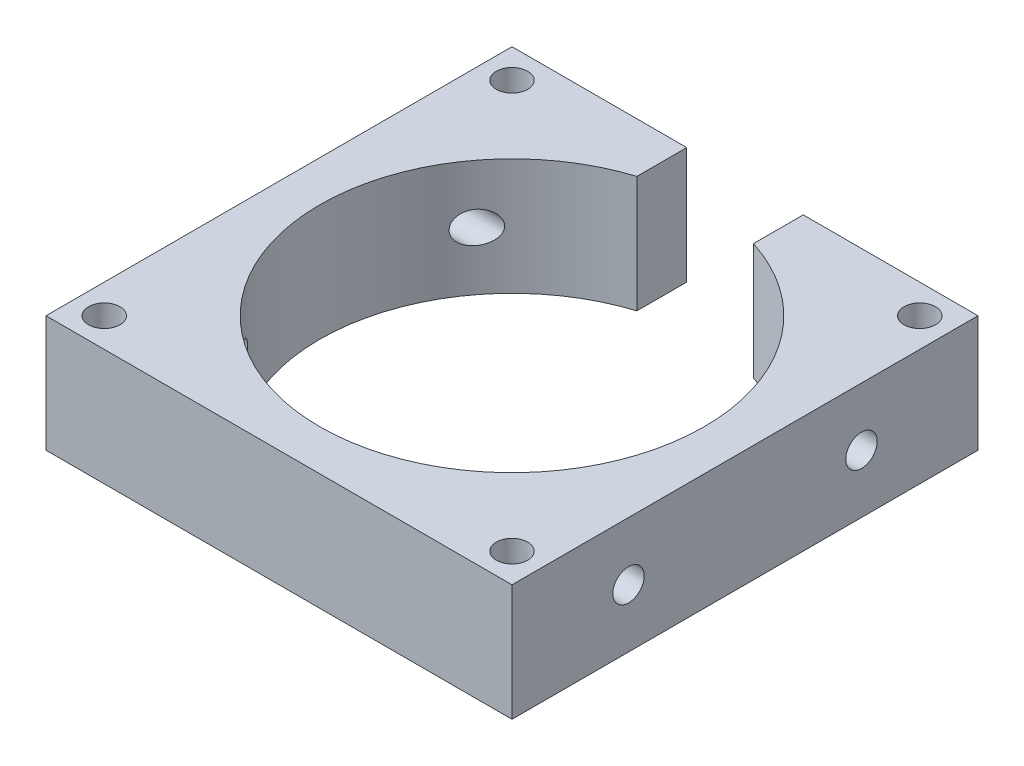
from build123d import *

# Parameters (mm, degrees)
SKETCH1_W           = 101.6
SKETCH1_H           = 101.6
BOSS_EXTRUDE1_DEPTH = 25.4
SKETCH2_R           = 41.91
CUT_EXTRUDE1_DEPTH  = 77.2
SKETCH3_W           = 25.4
SKETCH3_H           = 34.66394105
CUT_EXTRUDE2_DEPTH  = 77.2
SKETCH4_R           = 3.429
CUT_EXTRUDE3_DEPTH  = 77.2
SKETCH5_R           = 3.429
CUT_EXTRUDE4_DEPTH  = 117.397422652


with BuildPart() as part:
    # Sketch1 → Boss-Extrude1 (new body)
    with BuildSketch(Plane(origin=(0, 0, 0), x_dir=(1, 0, 0), z_dir=(0, 1, 0))):
        Rectangle(SKETCH1_W, SKETCH1_H)
    extrude(amount=BOSS_EXTRUDE1_DEPTH)

    # Sketch2 → Cut-Extrude1 (cut, through all)
    with BuildSketch(Plane(origin=(0, 25.4, 0), x_dir=(1, 0, 0), z_dir=(0, 1, 0))):
        with Locations(Location((0, 0, 0), (0, 0, 270))):
            Circle(SKETCH2_R)
    extrude(amount=-CUT_EXTRUDE1_DEPTH, mode=Mode.SUBTRACT)

    # Sketch3 → Cut-Extrude2 (cut, through all)
    with BuildSketch(Plane(origin=(0, 0, 0), x_dir=(1, 0, 0), z_dir=(0, 1, 0))):
        with Locations((0, 50.8)):
            Rectangle(SKETCH3_W, SKETCH3_H)
    extrude(amount=CUT_EXTRUDE2_DEPTH, mode=Mode.SUBTRACT)

    # Sketch4 → Cut-Extrude3 (cut, through all)
    with BuildSketch(Plane(origin=(0, 25.4, 0), x_dir=(1, 0, 0), z_dir=(0, 1, 0))):
        with Locations(Location((-44.45, 44.45, 0), (0, 0, 270))):
            Circle(SKETCH4_R)
        with Locations(Location((44.45, 44.45, 0), (0, 0, 270))):
            Circle(SKETCH4_R)
        with Locations(Location((44.45, -44.45, 0), (0, 0, 270))):
            Circle(SKETCH4_R)
        with Locations(Location((-44.45, -44.45, 0), (0, 0, 270))):
            Circle(SKETCH4_R)
    extrude(amount=-CUT_EXTRUDE3_DEPTH, mode=Mode.SUBTRACT)

    # Sketch5 → Cut-Extrude4 (cut, through all)
    with BuildSketch(Plane.ZY.offset(50.8)):
        with Locations((-25.4, 12.7)):
            Circle(SKETCH5_R)
        with Locations((25.4, 12.7)):
            Circle(SKETCH5_R)
    extrude(amount=-CUT_EXTRUDE4_DEPTH, mode=Mode.SUBTRACT)


solid = part.part
